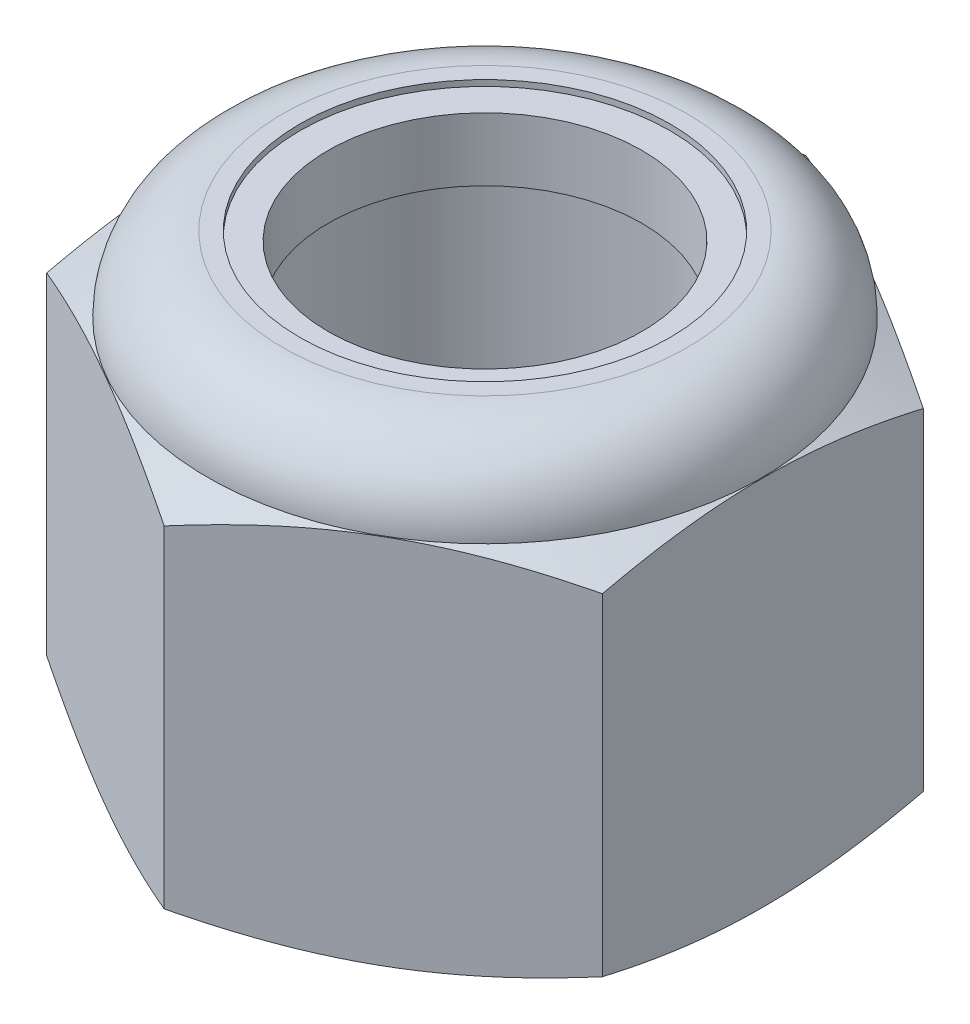
from build123d import *

# Parameters (mm, degrees)
BOSS_EXTRUDE1_DEPTH = 11.509375
SKETCH2_R           = 4.7625
CUT_EXTRUDE1_DEPTH  = 16.866785526


with BuildPart() as part:
    # Sketch1 → Boss-Extrude1 (new body)
    with BuildSketch(Plane(origin=(0, 0, 0), x_dir=(1, 0, 0), z_dir=(0, 1, 0))):
        Polygon((0, 8.256224319), (-7.1501, 4.12811216), (-7.1501, -4.12811216), (0, -8.256224319), (7.1501, -4.12811216), (7.1501, 4.12811216), align=None)
    extrude(amount=BOSS_EXTRUDE1_DEPTH)

    # Sketch2 → Cut-Extrude1 (cut, through all)
    with BuildSketch(Plane(origin=(0, 11.509375, 0), x_dir=(1, 0, 0), z_dir=(0, 1, 0))):
        with Locations(Location((0, 0, 0), (0, 0, 270))):
            Circle(SKETCH2_R)
    extrude(amount=-CUT_EXTRUDE1_DEPTH, mode=Mode.SUBTRACT)

    # Sketch4 → Cut-Revolve1 (revolve, cut)
    with BuildSketch(Plane(origin=(0, 0, 0), x_dir=(0, 0, -1), z_dir=(1, 0, 0))):
        with BuildLine():
            Line((0, 0), (7.138624319, 0))
            Line((7.138624319, 0), (8.256224319, 0.521145439))
            Line((8.256224319, 0.521145439), (8.256224319, 9.057829561))
            Line((8.256224319, 9.057829561), (7.138624319, 9.578975))
            ThreePointArc((7.138624319, 9.578975), (6.57322325, 10.94397393), (5.208224319, 11.509375))
            Line((5.208224319, 11.509375), (5.208224319, 12.779375))
            Line((5.208224319, 12.779375), (9.526224319, 12.779375))
            Line((9.526224319, 12.779375), (9.526224319, -1.27))
            Line((9.526224319, -1.27), (0, -1.27))
            Line((0, -1.27), (0, 0))
        make_face()
    revolve(axis=Axis((0, 0, 0), (0, 1, 0)), mode=Mode.SUBTRACT)

    # Sketch5 → Cut-Revolve2 (revolve, cut)
    with BuildSketch(Plane(origin=(0, 0, 0), x_dir=(0, 0, -1), z_dir=(1, 0, 0)), mode=Mode.PRIVATE) as cut_revolve2_sk:
        with BuildLine():
            Line((6.986224319, 9.578975), (0, 9.578975))
            Line((0, 9.578975), (0, 12.118975))
            Line((0, 12.118975), (4.6228, 12.118975))
            Line((4.6228, 12.118975), (4.6228, 11.356975))
            Line((4.6228, 11.356975), (5.208224319, 11.356975))
            ThreePointArc((5.208224319, 11.356975), (6.465460176, 10.836210857), (6.986224319, 9.578975))
        make_face()
    revolve(cut_revolve2_sk.sketch.rotate(Axis((0, 9.578975, 0), (0, 1, 0)), 180), axis=Axis((0, 9.578975, 0), (0, 1, 0)), mode=Mode.SUBTRACT)


with BuildPart() as body_2:
    # Sketch6 → Revolve1 (revolve)
    with BuildSketch(Plane(origin=(0, 0, 0), x_dir=(0, 0, -1), z_dir=(1, 0, 0))):
        with BuildLine():
            Line((4.0386, 9.655175), (4.0386, 11.280775))
            Line((4.0386, 11.280775), (5.208224319, 11.280775))
            ThreePointArc((5.208224319, 11.280775), (6.384329349, 10.808975081), (6.908317493, 9.655175))
            Line((6.908317493, 9.655175), (4.0386, 9.655175))
        make_face()
    revolve(axis=Axis((0, 0, 0), (0, 1, 0)))


solid = Compound([part.part, body_2.part])
